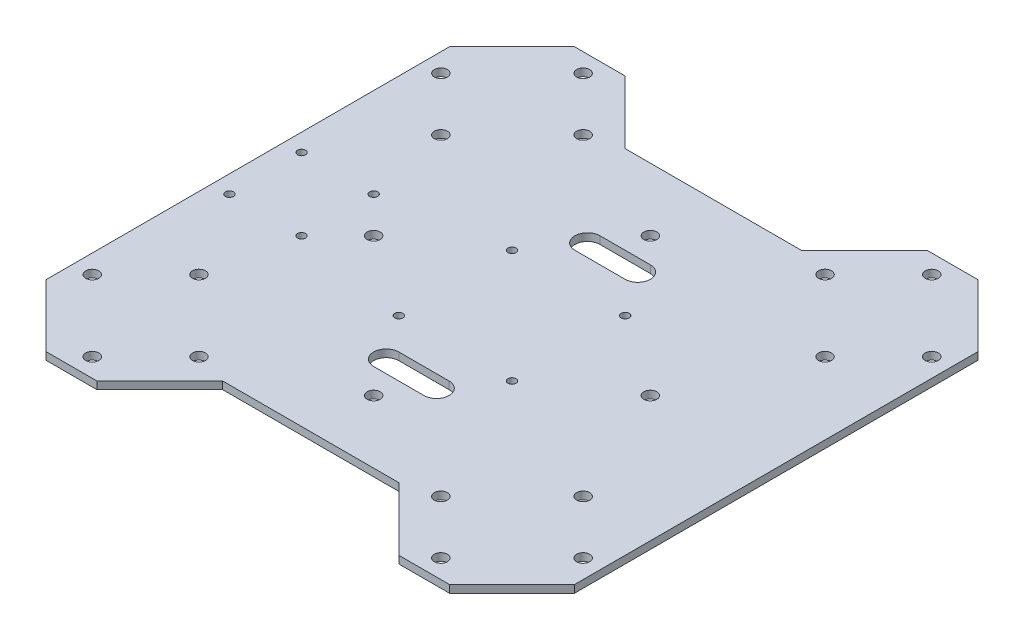
from build123d import *

# Parameters (mm, degrees)
BOSS_EXTRUDE1_DEPTH = 3
BOSS_EXTRUDE2_DEPTH = 2
CUT_EXTRUDE4_DEPTH  = 167.076115532
SKETCH3_R           = 2.6
CUT_EXTRUDE5_DEPTH  = 167.076115532
CUT_EXTRUDE7_DEPTH  = 167.076115532
SKETCH11_R          = 1.6
CUT_EXTRUDE10_DEPTH = 10
SKETCH12_R          = 2.6
CUT_EXTRUDE12_DEPTH = 10
CUT_EXTRUDE13_DEPTH = 167.076115532


with BuildPart() as part:
    # Sketch1 → Boss-Extrude1 (new body)
    with BuildSketch(Plane(origin=(0, 0, 0), x_dir=(1, 0, 0), z_dir=(0, 1, 0))):
        Polygon((-59.316686906, 108.225499677), (101.185838411, 108.225499677), (125.934575753, 83.476762335), (125.934575753, -77.025762982), (101.185838411, -101.774500323), (-59.316686906, -101.774500323), (-84.065424247, -77.025762982), (-84.065424247, 83.476762335), align=None)
    extrude(amount=BOSS_EXTRUDE1_DEPTH)

    # Sketch2 → Boss-Extrude2 (add)
    with BuildSketch(Plane(origin=(0, 3, 0), x_dir=(1, 0, 0), z_dir=(0, 1, 0))):
        Polygon((-84.065424247, -77.025762982), (-45.174551282, -38.134890016), (-20.425813941, -62.883627358), (-59.316686906, -101.774500323), align=None)
        Polygon((125.934575753, -77.025762982), (93.880849872, -37.104770943), (66.751068905, -58.888061335), (101.185838411, -101.774500323), align=None)
        Polygon((101.185838411, 108.225499677), (62.16108336, 69.955487183), (86.665825958, 44.96747398), (125.934575753, 83.476762335), align=None)
        Polygon((-59.316686906, 108.225499677), (-24.100270952, 65.978558399), (-50.874640527, 43.659845911), (-84.065424247, 83.476762335), align=None)
    extrude(amount=-BOSS_EXTRUDE2_DEPTH)

    # Sketch7 → Cut-Extrude4 (cut, through all)
    with BuildSketch(Plane(origin=(0, 3, 0), x_dir=(1, 0, 0), z_dir=(0, 1, 0))):
        with BuildLine():
            ThreePointArc((-1.565424247, -17.674500323), (-2.696795097, -20.405871173), (0.034575753, -19.274500323))
            Line((0.034575753, -19.274500323), (-1.565424247, -19.274500323))
            Line((-1.565424247, -19.274500323), (-1.565424247, -17.674500323))
        make_face()
        with BuildLine():
            Line((-1.565424247, -19.274500323), (0.034575753, -19.274500323))
            ThreePointArc((0.034575753, -19.274500323), (-0.434053398, -18.143129473), (-1.565424247, -17.674500323))
            Line((-1.565424247, -17.674500323), (-1.565424247, -19.274500323))
        make_face()
        with BuildLine():
            ThreePointArc((43.434575753, -17.674500323), (42.303204903, -18.143129473), (41.834575753, -19.274500323))
            Line((41.834575753, -19.274500323), (43.434575753, -19.274500323))
            Line((43.434575753, -19.274500323), (43.434575753, -17.674500323))
        make_face()
        with BuildLine():
            Line((43.434575753, -19.274500323), (41.834575753, -19.274500323))
            ThreePointArc((41.834575753, -19.274500323), (43.434575753, -20.874500323), (45.034575753, -19.274500323))
            ThreePointArc((45.034575753, -19.274500323), (44.565946602, -18.143129473), (43.434575753, -17.674500323))
            Line((43.434575753, -17.674500323), (43.434575753, -19.274500323))
        make_face()
        with BuildLine():
            ThreePointArc((45.034575753, 25.725499677), (43.434575753, 27.325499677), (41.834575753, 25.725499677))
            Line((41.834575753, 25.725499677), (43.434575753, 25.725499677))
            Line((43.434575753, 25.725499677), (43.434575753, 24.125499677))
            ThreePointArc((43.434575753, 24.125499677), (44.565946602, 24.594128827), (45.034575753, 25.725499677))
        make_face()
        with BuildLine():
            Line((43.434575753, 25.725499677), (41.834575753, 25.725499677))
            ThreePointArc((41.834575753, 25.725499677), (42.303204903, 24.594128827), (43.434575753, 24.125499677))
            Line((43.434575753, 24.125499677), (43.434575753, 25.725499677))
        make_face()
        with BuildLine():
            ThreePointArc((-1.565424247, 24.125499677), (-0.434053398, 24.594128827), (0.034575753, 25.725499677))
            Line((0.034575753, 25.725499677), (-1.565424247, 25.725499677))
            Line((-1.565424247, 25.725499677), (-1.565424247, 24.125499677))
        make_face()
        with BuildLine():
            Line((-1.565424247, 25.725499677), (0.034575753, 25.725499677))
            ThreePointArc((0.034575753, 25.725499677), (-2.696795097, 26.856870527), (-1.565424247, 24.125499677))
            Line((-1.565424247, 24.125499677), (-1.565424247, 25.725499677))
        make_face()
    extrude(amount=-CUT_EXTRUDE4_DEPTH, mode=Mode.SUBTRACT)

    # Sketch3 → Cut-Extrude5 (cut, through all)
    with BuildSketch(Plane(origin=(0, 3, 0), x_dir=(1, 0, 0), z_dir=(0, 1, 0))):
        with Locations(Location((-27.143328362, 79.587675039, 0), (0, 0, 270))):
            Circle(SKETCH3_R)
        with Locations(Location((-55.427599609, 51.303403791, 0), (0, 0, 270))):
            Circle(SKETCH3_R)
        with Locations(Location((-76.640803045, 72.516607227, 0), (0, 0, 270))):
            Circle(SKETCH3_R)
        with Locations(Location((-48.356531798, 100.800878474, 0), (0, 0, 270))):
            Circle(SKETCH3_R)
        with Locations(Location((118.50995455, 72.516607227, 0), (0, 0, 90))):
            Circle(SKETCH3_R)
        with Locations(Location((97.296751114, 51.303403791, 0), (0, 0, 90))):
            Circle(SKETCH3_R)
        with Locations(Location((69.012479867, 79.587675039, 0), (0, 0, 90))):
            Circle(SKETCH3_R)
        with Locations(Location((90.225683303, 100.800878474, 0), (0, 0, 90))):
            Circle(SKETCH3_R)
        with Locations(Location((97.296751114, -44.852404438, 0), (0, 0, 270))):
            Circle(SKETCH3_R)
        with Locations(Location((118.50995455, -66.065607873, 0), (0, 0, 270))):
            Circle(SKETCH3_R)
        with Locations(Location((90.225683303, -94.349879121, 0), (0, 0, 270))):
            Circle(SKETCH3_R)
        with Locations(Location((69.012479867, -73.136675685, 0), (0, 0, 270))):
            Circle(SKETCH3_R)
        with Locations(Location((-27.143328362, -73.136675685, 0), (0, 0, 90))):
            Circle(SKETCH3_R)
        with Locations(Location((-55.427599609, -44.852404438, 0), (0, 0, 90))):
            Circle(SKETCH3_R)
        with Locations(Location((-76.640803045, -66.065607873, 0), (0, 0, 90))):
            Circle(SKETCH3_R)
        with Locations(Location((-48.356531798, -94.349879121, 0), (0, 0, 90))):
            Circle(SKETCH3_R)
    extrude(amount=-CUT_EXTRUDE5_DEPTH, mode=Mode.SUBTRACT)

    # Sketch9 → Cut-Extrude7 (cut, through all)
    with BuildSketch(Plane(origin=(0, 3, 0), x_dir=(1, 0, 0), z_dir=(0, 1, 0))):
        Polygon((-14.065424247, 83.225499677), (55.934575753, 83.225499677), (80.934575753, 108.225499677), (-39.065424247, 108.225499677), align=None)
        Polygon((-14.065424247, -76.774500323), (-39.065424247, -101.774500323), (80.934575753, -101.774500323), (55.934575753, -76.774500323), align=None)
    extrude(amount=-CUT_EXTRUDE7_DEPTH, mode=Mode.SUBTRACT)

    # Sketch11 → Cut-Extrude10 (cut)
    with BuildSketch(Plane(origin=(0, 3, 0), x_dir=(1, 0, 0), z_dir=(0, 1, 0))):
        with Locations(Location((-77.065424247, 17.565499677, 0), (0, 0, 270))):
            Circle(SKETCH11_R)
        with Locations(Location((-77.065424247, -11.114500323, 0), (0, 0, 270))):
            Circle(SKETCH11_R)
        with Locations(Location((-48.385424247, 17.565499677, 0), (0, 0, 270))):
            Circle(SKETCH11_R)
        with Locations(Location((-48.385424247, -11.114500323, 0), (0, 0, 90))):
            Circle(SKETCH11_R)
    extrude(amount=-CUT_EXTRUDE10_DEPTH, mode=Mode.SUBTRACT)

    # Sketch12 → Cut-Extrude12 (cut)
    with BuildSketch(Plane(origin=(0, 3, 0), x_dir=(1, 0, 0), z_dir=(0, 1, 0))):
        with Locations(Location((-34.065424247, 3.225499677, 0), (0, 0, 270))):
            Circle(SKETCH12_R)
        with Locations(Location((20.934575753, -51.774500323, 0), (0, 0, 270))):
            Circle(SKETCH12_R)
        with Locations(Location((75.934575753, 3.225499677, 0), (0, 0, 270))):
            Circle(SKETCH12_R)
        with Locations(Location((20.934575753, 58.225499677, 0), (0, 0, 270))):
            Circle(SKETCH12_R)
    extrude(amount=-CUT_EXTRUDE12_DEPTH, mode=Mode.SUBTRACT)

    # Sketch13 → Cut-Extrude13 (cut, through all)
    with BuildSketch(Plane(origin=(0, 3, 0), x_dir=(1, 0, 0), z_dir=(0, 1, 0))):
        with BuildLine():
            Line((10.934575753, -41.774500323), (30.934575753, -41.774500323))
            ThreePointArc((30.934575753, -41.774500323), (35.934575753, -36.774500323), (30.934575753, -31.774500323))
            Line((30.934575753, -31.774500323), (10.934575753, -31.774500323))
            ThreePointArc((10.934575753, -31.774500323), (5.934575753, -36.774500323), (10.934575753, -41.774500323))
        make_face()
        with BuildLine():
            Line((10.934575753, 38.225499677), (30.934575753, 38.225499677))
            ThreePointArc((30.934575753, 38.225499677), (35.934575753, 43.225499677), (30.934575753, 48.225499677))
            Line((30.934575753, 48.225499677), (10.934575753, 48.225499677))
            ThreePointArc((10.934575753, 48.225499677), (5.934575753, 43.225499677), (10.934575753, 38.225499677))
        make_face()
    extrude(amount=-CUT_EXTRUDE13_DEPTH, mode=Mode.SUBTRACT)


solid = part.part
